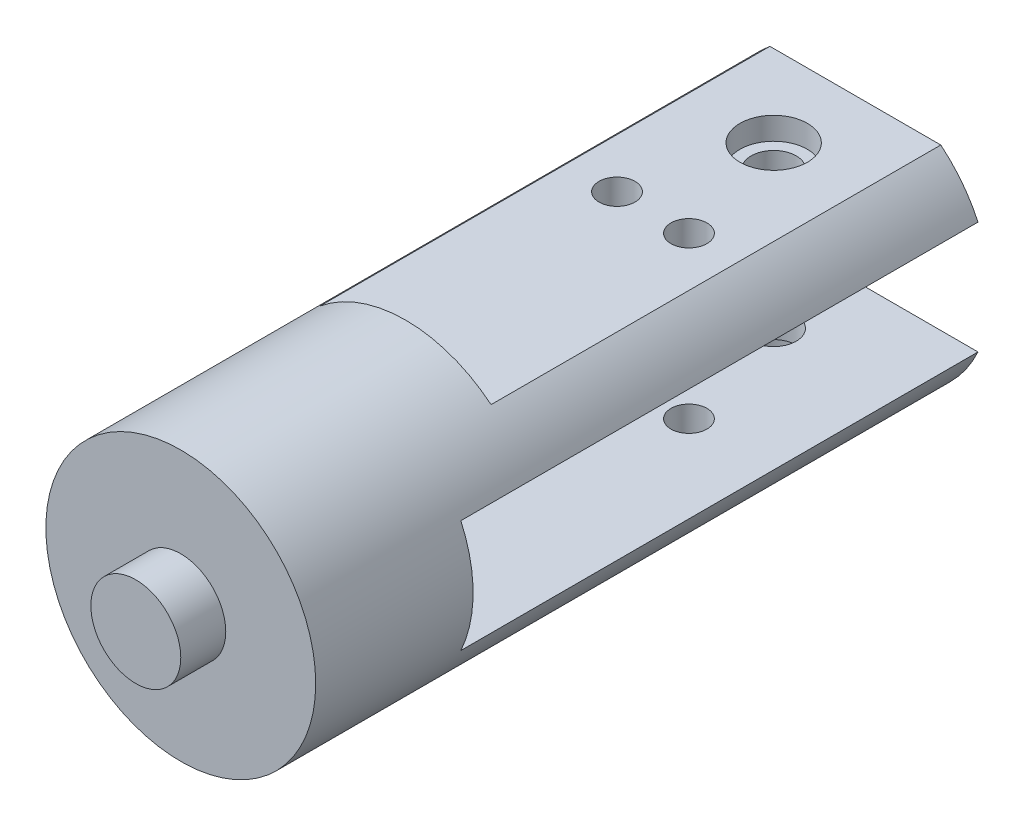
from build123d import *

# Parameters (mm, degrees)
IZIM1_R                     = 30
IZIM1_R_2                   = 10
Y_KSEKLIK_EKSTR_ZYON2_DEPTH = 25
IZIM1_4_R                   = 10
Y_KSEKLIK_EKSTR_ZYON3_DEPTH = 35
Y_KSEKLIK_EKSTR_ZYON4_START = -125
IZIM1_5_R                   = 30
IZIM1_5_R_2                 = 10
Y_KSEKLIK_EKSTR_ZYON4_DEPTH = 125
IZIM3_W                     = 54.543560574
IZIM3_H                     = 25
KES_EKSTR_ZYON1_DEPTH       = 115
KES_EKSTR_ZYON2_DEPTH       = 100
IZIM5_R                     = 4
KES_EKSTR_ZYON3_DEPTH       = 100
KES_EKSTR_ZYON4_DEPTH       = 5
KES_EKSTR_ZYON5_DEPTH       = 35.716373532
L_EK1_SCALE                 = 0.2


with BuildPart() as part:
    # Çizim1 → Yükseklik-Ekstrüzyon2 (new body)
    # profile 1 of 2: a face of its own
    with BuildSketch(Plane.XY):
        Circle(IZIM1_R)
        Circle(IZIM1_R_2, mode=Mode.SUBTRACT)
    # profile 2 of 2: a face of its own
    with BuildSketch(Plane.XY):
        Circle(IZIM1_R_2)
    extrude(amount=Y_KSEKLIK_EKSTR_ZYON2_DEPTH)

    # Çizim1<4> → Yükseklik-Ekstrüzyon3 (add)
    with BuildSketch(Plane.XY):
        Circle(IZIM1_4_R)
    extrude(amount=Y_KSEKLIK_EKSTR_ZYON3_DEPTH)

    # Çizim1<5> → Yükseklik-Ekstrüzyon4 (add)
    # profile 1 of 2: a face of its own
    with BuildSketch(Plane.XY.offset(Y_KSEKLIK_EKSTR_ZYON4_START)):
        Circle(IZIM1_5_R)
        Circle(IZIM1_5_R_2, mode=Mode.SUBTRACT)
    # profile 2 of 2: a face of its own
    with BuildSketch(Plane.XY.offset(Y_KSEKLIK_EKSTR_ZYON4_START)):
        Circle(IZIM1_5_R_2)
    extrude(amount=Y_KSEKLIK_EKSTR_ZYON4_DEPTH)

    # Çizim3 → Kes-Ekstrüzyon1 (cut)
    with BuildSketch(Plane(origin=(0, 0, -125), x_dir=(-1, 0, 0), z_dir=(0, 0, -1))):
        Rectangle(IZIM3_W, IZIM3_H)
        with BuildLine():
            Line((-27.271780287, -12.5), (-27.271780287, 12.5))
            ThreePointArc((-27.271780287, 12.5), (-30, 0), (-27.271780287, -12.5))
        make_face()
        with BuildLine():
            ThreePointArc((27.271780287, -12.5), (30, 0), (27.271780287, 12.5))
            Line((27.271780287, 12.5), (27.271780287, -12.5))
        make_face()
    extrude(amount=-KES_EKSTR_ZYON1_DEPTH, mode=Mode.SUBTRACT)

    # Çizim4 → Kes-Ekstrüzyon2 (cut)
    with BuildSketch(Plane(origin=(0, 0, -125), x_dir=(-1, 0, 0), z_dir=(0, 0, -1))):
        with BuildLine():
            Line((-19, 23.216373532), (19, 23.216373532))
            ThreePointArc((19, 23.216373532), (0, 30), (-19, 23.216373532))
        make_face()
        with BuildLine():
            Line((-19, -23.216373532), (19, -23.216373532))
            ThreePointArc((19, -23.216373532), (0, -30), (-19, -23.216373532))
        make_face()
    extrude(amount=-KES_EKSTR_ZYON2_DEPTH, mode=Mode.SUBTRACT)

    # Çizim5 → Kes-Ekstrüzyon3 (cut)
    with BuildSketch(Plane(origin=(0, 23.216373532, 0), x_dir=(1, 0, 0), z_dir=(0, 1, 0))):
        with Locations(Location((-8, 80, 0), (0, 0, 270))):
            Circle(IZIM5_R)
        with Locations(Location((8, 80, 0), (0, 0, 270))):
            Circle(IZIM5_R)
    extrude(amount=-KES_EKSTR_ZYON3_DEPTH, mode=Mode.SUBTRACT)

    # Çizim6 → Kes-Ekstrüzyon4 (cut)
    with BuildSketch(Plane(origin=(0, 23.216373532, 0), x_dir=(1, 0, 0), z_dir=(0, 1, 0))):
        with BuildLine():
            ThreePointArc((5, 106.843021333), (3.535533906, 110.378555239), (0, 111.843021333))
            Line((0, 111.843021333), (0, 101.843021333))
            ThreePointArc((0, 101.843021333), (3.535533906, 103.307487427), (5, 106.843021333))
        make_face()
        with BuildLine():
            Line((0, 101.843021333), (0, 111.843021333))
            ThreePointArc((0, 111.843021333), (-5, 106.843021333), (0, 101.843021333))
        make_face()
        with BuildLine():
            ThreePointArc((7.5, 106.843021333), (5.303300859, 112.146322192), (0, 114.343021333))
            Line((0, 114.343021333), (0, 111.843021333))
            ThreePointArc((0, 111.843021333), (3.535533906, 110.378555239), (5, 106.843021333))
            ThreePointArc((5, 106.843021333), (3.535533906, 103.307487427), (0, 101.843021333))
            Line((0, 101.843021333), (0, 99.343021333))
            ThreePointArc((0, 99.343021333), (5.303300859, 101.539720474), (7.5, 106.843021333))
        make_face()
        with BuildLine():
            Line((0, 111.843021333), (0, 114.343021333))
            ThreePointArc((0, 114.343021333), (-7.5, 106.843021333), (0, 99.343021333))
            Line((0, 99.343021333), (0, 101.843021333))
            ThreePointArc((0, 101.843021333), (-5, 106.843021333), (0, 111.843021333))
        make_face()
    kes_ekstr_zyon4 = extrude(amount=-KES_EKSTR_ZYON4_DEPTH, mode=Mode.SUBTRACT)

    # Çizim6<3> → Kes-Ekstrüzyon5 (cut)
    with BuildSketch(Plane(origin=(0, 23.216373532, 0), x_dir=(1, 0, 0), z_dir=(0, 1, 0))):
        with BuildLine():
            ThreePointArc((5, 106.843021333), (3.535533906, 110.378555239), (0, 111.843021333))
            Line((0, 111.843021333), (0, 101.843021333))
            ThreePointArc((0, 101.843021333), (3.535533906, 103.307487427), (5, 106.843021333))
        make_face()
        with BuildLine():
            Line((0, 101.843021333), (0, 111.843021333))
            ThreePointArc((0, 111.843021333), (-5, 106.843021333), (0, 101.843021333))
        make_face()
    kes_ekstr_zyon5 = extrude(amount=-KES_EKSTR_ZYON5_DEPTH, mode=Mode.SUBTRACT)

    # Aynalama1: Kes-Ekstrüzyon4, Kes-Ekstrüzyon5 across plane
    add(kes_ekstr_zyon4.mirror(Plane.ZX), mode=Mode.SUBTRACT)
    add(kes_ekstr_zyon5.mirror(Plane.ZX), mode=Mode.SUBTRACT)


with BuildPart() as part_1:
    # Ölçek1: scaled about (0, 0, -30.54358769)
    add(part.part.scale(L_EK1_SCALE).moved(Location((0, 0, -24.434870152))))


solid = part_1.part
